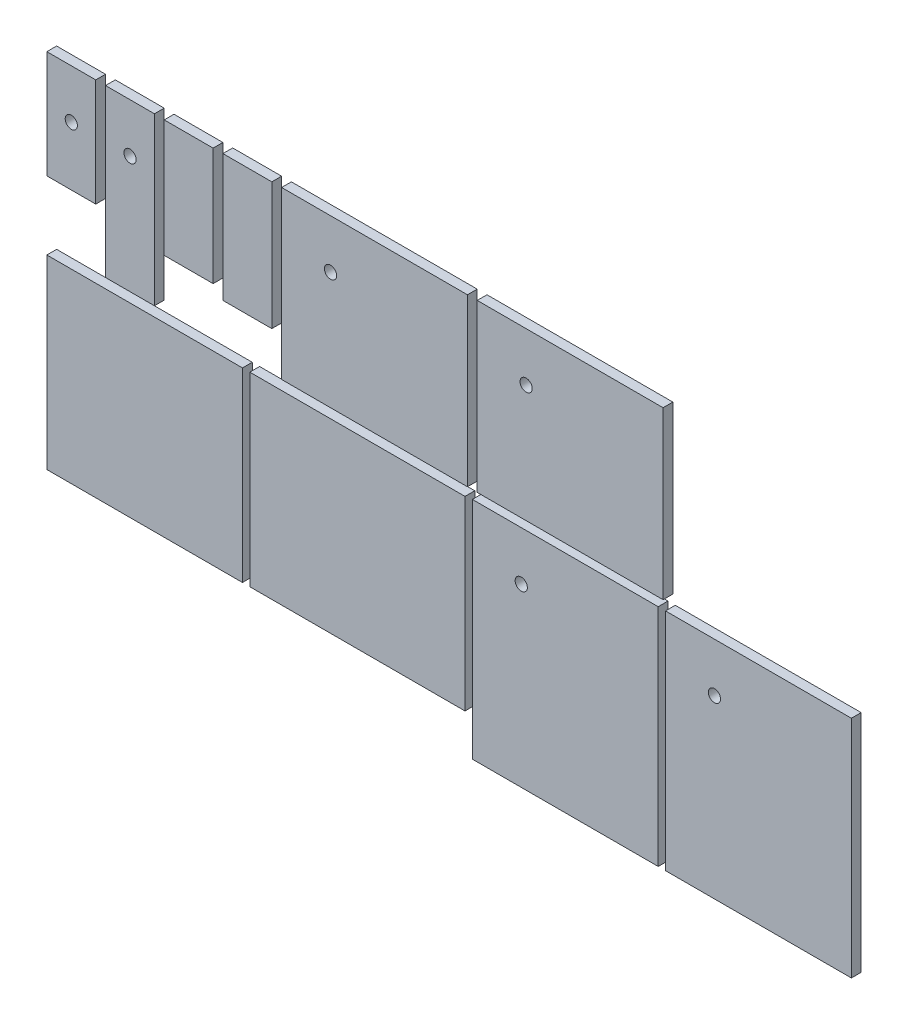
from build123d import *

# Parameters (mm, degrees)
SKETCH1_W              = 25.4
SKETCH1_H              = 55.88
SKETCH1_R              = 3.175
BOSS_EXTRUDE1_DEPTH    = 5.08
SKETCH1_H_2            = 86.36
BOSS_EXTRUDE1_2_DEPTH  = 5.08
SKETCH1_H_3            = 60.96
BOSS_EXTRUDE1_3_DEPTH  = 5.08
SKETCH1_H_4            = 66.04
BOSS_EXTRUDE1_4_DEPTH  = 5.08
SKETCH1_W_2            = 101.6
SKETCH1_H_5            = 96.52
BOSS_EXTRUDE1_5_DEPTH  = 5.08
SKETCH1_W_3            = 111.76
BOSS_EXTRUDE1_6_DEPTH  = 5.08
SKETCH1_W_4            = 96.52
BOSS_EXTRUDE1_7_DEPTH  = 5.08
BOSS_EXTRUDE1_8_DEPTH  = 5.08
SKETCH1_H_6            = 116.84
BOSS_EXTRUDE1_9_DEPTH  = 5.08
BOSS_EXTRUDE1_10_DEPTH = 5.08


with BuildPart() as part:
    # Sketch1 → Boss-Extrude1 (new body)
    with BuildSketch(Plane.XY):
        with Locations((-40.59263907, 30.033148148)):
            Rectangle(SKETCH1_W, SKETCH1_H)
        with Locations((-40.59263907, 32.573148148)):
            Circle(SKETCH1_R, mode=Mode.SUBTRACT)
    extrude(amount=BOSS_EXTRUDE1_DEPTH)


with BuildPart() as body_2:
    # Sketch1 → Boss-Extrude1 2 (new body)
    with BuildSketch(Plane.XY):
        with Locations((-10.11263907, 14.793148148)):
            Rectangle(SKETCH1_W, SKETCH1_H_2)
        with Locations((-10.11263907, 32.573148148)):
            Circle(SKETCH1_R, mode=Mode.SUBTRACT)
    extrude(amount=BOSS_EXTRUDE1_2_DEPTH)


with BuildPart() as body_3:
    # Sketch1 → Boss-Extrude1 3 (new body)
    with BuildSketch(Plane.XY):
        with Locations((20.36736093, 27.290748183)):
            Rectangle(SKETCH1_W, SKETCH1_H_3)
    extrude(amount=BOSS_EXTRUDE1_3_DEPTH)


with BuildPart() as body_4:
    # Sketch1 → Boss-Extrude1 4 (new body)
    with BuildSketch(Plane.XY):
        with Locations((50.84736093, 24.829806874)):
            Rectangle(SKETCH1_W, SKETCH1_H_4)
    extrude(amount=BOSS_EXTRUDE1_4_DEPTH)


with BuildPart() as body_5:
    # Sketch1 → Boss-Extrude1 5 (new body)
    with BuildSketch(Plane.XY):
        with Locations((-2.49263907, -81.726851852)):
            Rectangle(SKETCH1_W_2, SKETCH1_H_5)
    extrude(amount=BOSS_EXTRUDE1_5_DEPTH)


with BuildPart() as body_6:
    # Sketch1 → Boss-Extrude1 6 (new body)
    with BuildSketch(Plane.XY):
        with Locations((107.99736093, -81.726851852)):
            Rectangle(SKETCH1_W_3, SKETCH1_H_5)
    extrude(amount=BOSS_EXTRUDE1_6_DEPTH)


with BuildPart() as body_7:
    # Sketch1 → Boss-Extrude1 7 (new body)
    with BuildSketch(Plane.XY):
        with Locations((116.88736093, 14.669806874)):
            Rectangle(SKETCH1_W_4, SKETCH1_H_2)
        with Locations((94.02736093, 32.449806874)):
            Circle(SKETCH1_R, mode=Mode.SUBTRACT)
    extrude(amount=BOSS_EXTRUDE1_7_DEPTH)


with BuildPart() as body_8:
    # Sketch1 → Boss-Extrude1 8 (new body)
    with BuildSketch(Plane.XY):
        with Locations((218.48736093, 14.669806874)):
            Rectangle(SKETCH1_W_4, SKETCH1_H_2)
        with Locations((195.62736093, 32.449806874)):
            Circle(SKETCH1_R, mode=Mode.SUBTRACT)
    extrude(amount=BOSS_EXTRUDE1_8_DEPTH)


with BuildPart() as body_9:
    # Sketch1 → Boss-Extrude1 9 (new body)
    with BuildSketch(Plane.XY):
        with Locations((215.94736093, -91.329602177)):
            Rectangle(SKETCH1_W_4, SKETCH1_H_6)
        with Locations((193.08736093, -58.309602177)):
            Circle(SKETCH1_R, mode=Mode.SUBTRACT)
    extrude(amount=BOSS_EXTRUDE1_9_DEPTH)


with BuildPart() as body_10:
    # Sketch1 → Boss-Extrude1 10 (new body)
    with BuildSketch(Plane.XY):
        with Locations((316.27736093, -91.329602177)):
            Rectangle(SKETCH1_W_4, SKETCH1_H_6)
        with Locations((293.41736093, -58.309602177)):
            Circle(SKETCH1_R, mode=Mode.SUBTRACT)
    extrude(amount=BOSS_EXTRUDE1_10_DEPTH)


solid = Compound([part.part, body_2.part, body_3.part, body_4.part, body_5.part, body_6.part, body_7.part, body_8.part, body_9.part, body_10.part])
